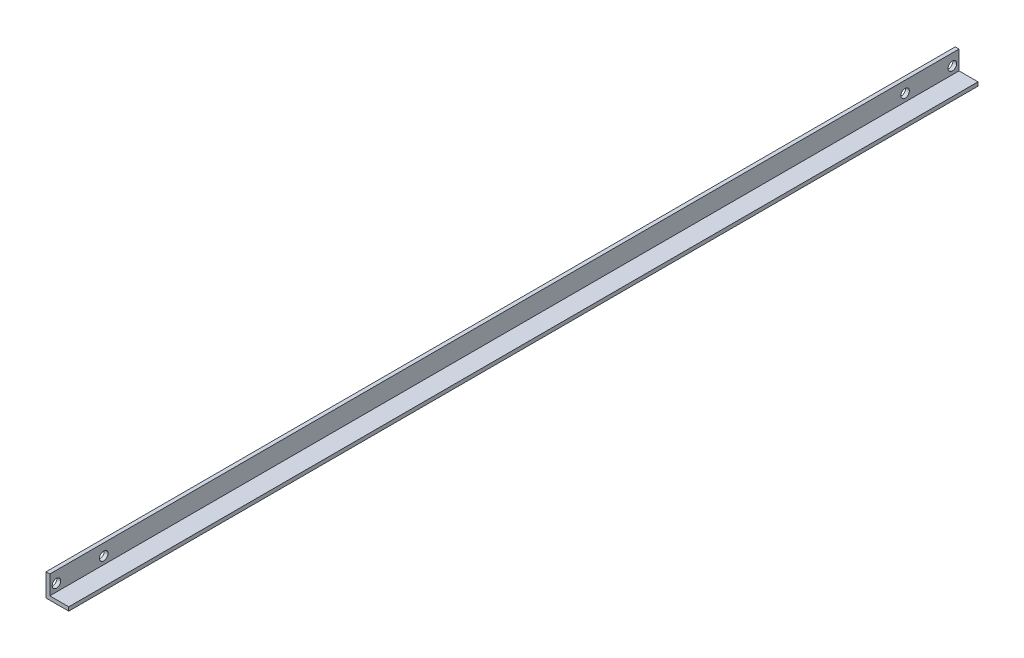
from build123d import *

# Parameters (mm, degrees)
BOSS_EXTRUDE1_DEPTH             = 762
F_9_32_0_28125_DIAMETER_HOLE1_D = 7.14375


with BuildPart() as part:
    # Sketch1 → Boss-Extrude1 (new body)
    with BuildSketch(Plane.XY):
        Polygon((0, 0), (19.05, 0), (19.05, 3.175), (3.175, 3.175), (3.175, 19.05), (0, 19.05), align=None)
    extrude(amount=BOSS_EXTRUDE1_DEPTH)

    # 9/32 (0.28125) Diameter Hole1 (through all)
    with Locations(Plane(origin=(0, 9.525, 5.588), x_dir=(0, -1, 0), z_dir=(-1, 0, 0))):
        with Locations((0, 0), (0, 39.624), (0, 711.199), (0, 750.824)):
            Hole(F_9_32_0_28125_DIAMETER_HOLE1_D / 2)


solid = part.part
